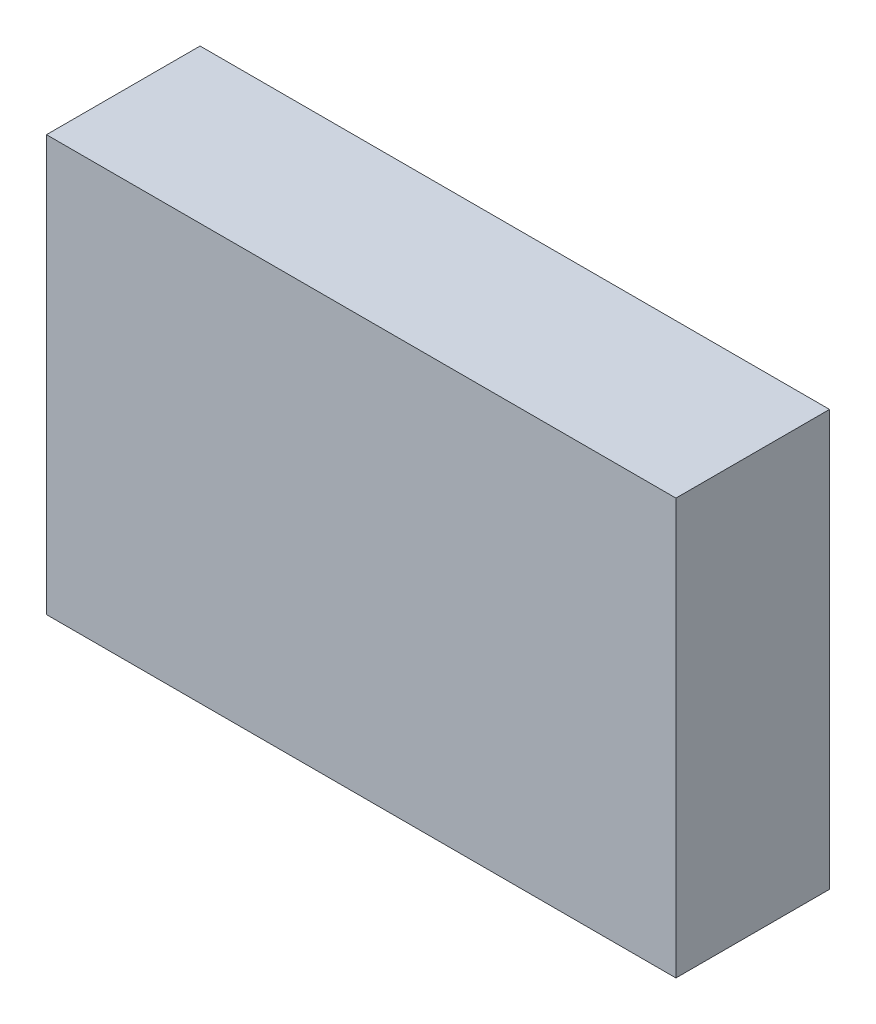
from build123d import *

# Parameters (mm, degrees)
SKETCH1_W           = 209
SKETCH1_H           = 138
BOSS_EXTRUDE1_DEPTH = 25.5


with BuildPart() as part:
    # Sketch1 → Boss-Extrude1 (new, symmetric)
    with BuildSketch(Plane.XY):
        Rectangle(SKETCH1_W, SKETCH1_H)
    extrude(amount=BOSS_EXTRUDE1_DEPTH, both=True)


solid = part.part
